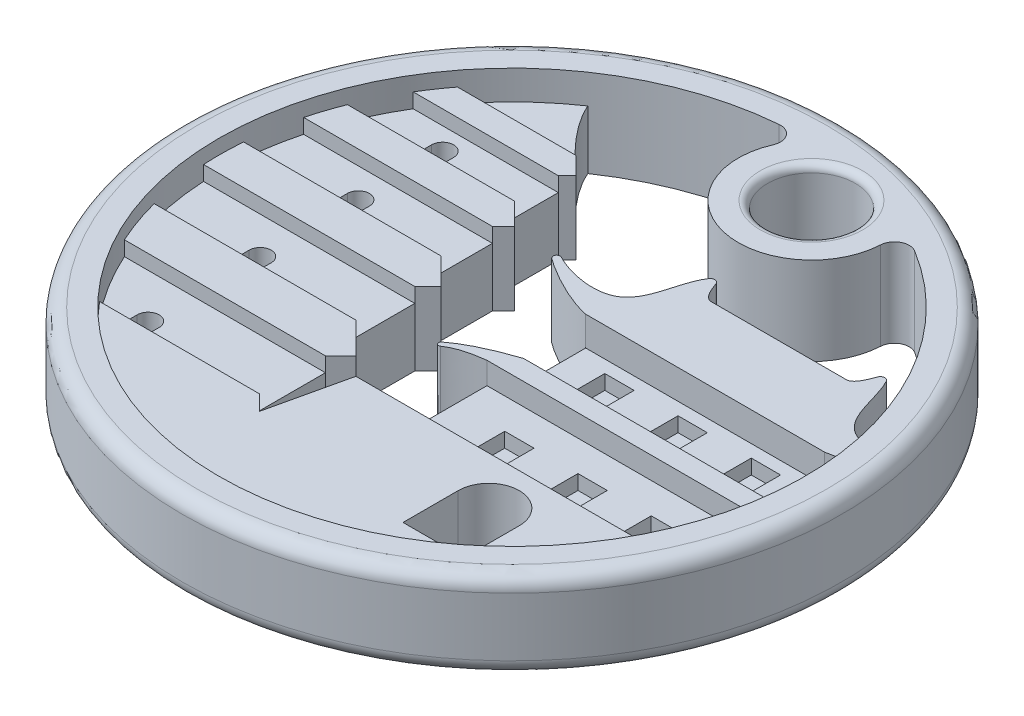
from build123d import *

# Parameters (mm, degrees)
SKETCH_1_R          = 22.5
SKETCH_1_R_2        = 20
EXTRUDE_1_DEPTH     = 6
EXTRUDE_2_DEPTH     = 4
EXTRUDE_3_DEPTH     = 5
EXTRUDE_5_DEPTH     = 4.5
SKETCH_3_5_W        = 18.604278743
SKETCH_3_5_H        = 5.922046806
SKETCH_3_5_W_2      = 16.316712287
SKETCH_3_5_H_2      = 4.236162185
EXTRUDE_6_DEPTH     = 3
SKETCH_4_W          = 2
SKETCH_4_H          = 2
CUT_EXTRUDE_1_DEPTH = 1
SKETCH_5_R          = 5
SKETCH_5_R_2        = 3
EXTRUDE_7_DEPTH     = 6
FILLET_1_R          = 1
EXTRUDE_8_DEPTH     = 1
FILLET_2_R          = 0.5
FILLET_3_R          = 1


with BuildPart() as part:
    # 草图1 → 凸台-拉伸1 (new body)
    with BuildSketch(Plane(origin=(0, 0, 0), x_dir=(1, 0, 0), z_dir=(0, 1, 0))):
        Circle(SKETCH_1_R)
        Circle(SKETCH_1_R_2, mode=Mode.SUBTRACT)
    extrude(amount=EXTRUDE_1_DEPTH)

    # 草图2 → 凸台-拉伸2 (add)
    with BuildSketch(Plane(origin=(0, 0, 0), x_dir=(1, 0, 0), z_dir=(0, 1, 0))):
        with BuildLine():
            Line((-6.59839511, 10.960667775), (-7.79839511, 12.160667775))
            add(Edge.make_bspline(
                [(-7.79839511, 12.160667775), (-7.798415018, 12.160687684), (-7.919621711, 12.281894369), (-11.841073405, 15.613438943), (-11.65646465, 18.176175119)],
                knots=[0, 0, 0, 0, 0.05, 1, 1, 1, 1], degree=3))
            ThreePointArc((-11.65646465, 18.176175119), (-21.125358879, -4.468301951), (-3.29839511, -21.339332225))
            Line((-3.29839511, -21.339332225), (-3.29839511, -16.339332225))
            Line((-3.29839511, -16.339332225), (-2.09839511, -15.139332225))
            Line((-2.09839511, -15.139332225), (-4.49839511, -12.739332225))
            Line((-4.49839511, -12.739332225), (-4.49839511, -8.239332225))
            Line((-4.49839511, -8.239332225), (-3.44839511, -7.189332225))
            Line((-3.44839511, -7.189332225), (-5.54839511, -5.089332225))
            Line((-5.54839511, -5.089332225), (-5.54839511, -1.089332225))
            Line((-5.54839511, -1.089332225), (-4.64839511, -0.189332225))
            Line((-4.64839511, -0.189332225), (-6.44839511, 1.610667775))
            Line((-6.44839511, 1.610667775), (-6.44839511, 5.110667775))
            Line((-6.44839511, 5.110667775), (-5.69839511, 5.860667775))
            Line((-5.69839511, 5.860667775), (-7.19839511, 7.360667775))
            Line((-7.19839511, 7.360667775), (-7.19839511, 10.360667775))
            Line((-7.19839511, 10.360667775), (-6.59839511, 10.960667775))
        make_face()
        with BuildLine():
            Line((-12.849435762, -12.739332225), (-14.349435762, -12.739332225))
            Line((-14.349435762, -12.739332225), (-14.349435762, -11.239332225))
            ThreePointArc((-14.349435762, -11.239332225), (-13.599435762, -10.489332225), (-12.849435762, -11.239332225))
            Line((-12.849435762, -11.239332225), (-12.849435762, -12.739332225))
        make_face(mode=Mode.SUBTRACT)
        with BuildLine():
            Line((-12.849435762, -5.089332225), (-14.349435762, -5.089332225))
            Line((-14.349435762, -5.089332225), (-14.349435762, -3.589332225))
            ThreePointArc((-14.349435762, -3.589332225), (-13.599435762, -2.839332225), (-12.849435762, -3.589332225))
            Line((-12.849435762, -3.589332225), (-12.849435762, -5.089332225))
        make_face(mode=Mode.SUBTRACT)
        with BuildLine():
            Line((-12.849435762, 1.610667775), (-14.349435762, 1.610667775))
            Line((-14.349435762, 1.610667775), (-14.349435762, 3.110667775))
            ThreePointArc((-14.349435762, 3.110667775), (-13.599435762, 3.860667775), (-12.849435762, 3.110667775))
            Line((-12.849435762, 3.110667775), (-12.849435762, 1.610667775))
        make_face(mode=Mode.SUBTRACT)
        with BuildLine():
            Line((-12.849435762, 7.360667775), (-14.349435762, 7.360667775))
            Line((-14.349435762, 7.360667775), (-14.349435762, 8.860667775))
            ThreePointArc((-14.349435762, 8.860667775), (-13.599435762, 9.610667775), (-12.849435762, 8.860667775))
            Line((-12.849435762, 8.860667775), (-12.849435762, 7.360667775))
        make_face(mode=Mode.SUBTRACT)
    extrude(amount=EXTRUDE_2_DEPTH)

    # 草图3 → 凸台-拉伸3 (add)
    # profile 1 of 2: a face of its own
    with BuildSketch(Plane(origin=(0, 0, 0), x_dir=(1, 0, 0), z_dir=(0, 1, 0))):
        Polygon((11.687038437, -18.083208612), (14.631685412, -15.44347942), (19.814320488, -8.412341061), (-2.244619852, -8.412341061), (-3.843916309, -15.44347942), (-3.843916309, -20.722937804), (1.032924215, -21.162044464), (7.157306577, -19.775391854), align=None)
        with BuildLine():
            Line((12.165702371, -15.44347942), (8.003131578, -15.44347942))
            Line((8.003131578, -15.44347942), (8.003131578, -11.673118932))
            ThreePointArc((8.003131578, -11.673118932), (8.612725957, -10.201427915), (10.084416974, -9.591833536))
            ThreePointArc((10.084416974, -9.591833536), (11.556107992, -10.201427915), (12.165702371, -11.673118932))
            Line((12.165702371, -11.673118932), (12.165702371, -15.44347942))
        make_face(mode=Mode.SUBTRACT)
    # profile 2 of 2: a face of its own
    with BuildSketch(Plane(origin=(0, 0, 0), x_dir=(1, 0, 0), z_dir=(0, 1, 0))):
        with BuildLine():
            Line((1.926060831, 3.106313863), (18.242773118, 3.106313863))
            add(Edge.make_bspline(
                [(20.49726349, 3.758938379), (19.799785792, 3.382148266), (18.970151593, 3.258262591), (18.242773118, 3.106313863)],
                knots=[0.620726919, 0.620726919, 0.620726919, 0.620726919, 1, 1, 1, 1], degree=3))
            Line((20.49726349, 3.758938379), (20.145013664, 4.948010129))
            add(Edge.make_bspline(
                [(16.154345484, 9.400093966), (16.92049611, 7.978093658), (16.867354273, 5.096762577), (19.555271012, 4.894019573), (20.145013664, 4.948010129)],
                knots=[0, 0, 0, 0, 0.619573201, 0.781573575, 0.781573575, 0.781573575, 0.781573575], degree=3))
            ThreePointArc((16.154345484, 9.400093966), (15.862588788, 9.55922706), (15.599078269, 9.356723931))
            add(Edge.make_bspline(
                [(15.599078269, 9.356723931), (15.459599835, 8.960274552), (15.160667215, 8.130763445), (14.702603414, 8.130763445)],
                knots=[0, 0, 0, 0, 1, 1, 1, 1], degree=3))
            Line((14.702603414, 8.130763445), (5.466230535, 8.130763445))
            add(Edge.make_bspline(
                [(4.56975568, 9.356723931), (4.709234114, 8.960274552), (5.008166733, 8.130763445), (5.466230535, 8.130763445)],
                knots=[0, 0, 0, 0, 1, 1, 1, 1], degree=3))
            ThreePointArc((4.56975568, 9.356723931), (4.321771685, 9.557612959), (4.030680789, 9.42677507))
            add(Edge.make_bspline(
                [(4.030680789, 9.42677507), (3.122985939, 8.090675629), (3.427309753, 4.256953296), (-1.047441871, 4.989905533), (-2.275269877, 5.643307417)],
                knots=[0, 0, 0, 0, 0.619573201, 1, 1, 1, 1], degree=3))
            ThreePointArc((-2.275269877, 5.643307417), (-2.582782761, 5.567141086), (-2.539928013, 5.253247864))
            add(Edge.make_bspline(
                [(-2.539928013, 5.253247864), (-2.234855409, 4.994580773), (0.008238259, 3.506945323), (1.926060831, 3.106313863)],
                knots=[0, 0, 0, 0, 1, 1, 1, 1], degree=3))
        make_face()
    extrude(amount=EXTRUDE_3_DEPTH)

    # 草图3<4> → 凸台-拉伸5 (add)
    with BuildSketch(Plane(origin=(0, 0, 0), x_dir=(1, 0, 0), z_dir=(0, 1, 0))):
        with BuildLine():
            Line((0.782277603, -2.490294255), (19.386556346, -2.490294255))
            add(Edge.make_bspline(
                [(19.386556346, -2.490294255), (20.985174967, -2.667750056), (21.803810915, -3.242047767)],
                knots=[0, 0, 0, 1, 1, 1], degree=2))
            ThreePointArc((21.803810915, -3.242047767), (22.050579216, -3.201550422), (22.015512803, -2.953952005))
            add(Edge.make_bspline(
                [(18.242773118, -1.129848322), (20.685207654, -1.930646184), (22.015512803, -2.953952005)],
                knots=[0, 0, 0, 1, 1, 1], degree=2))
            Line((18.242773118, -1.129848322), (1.926060831, -1.129848322))
            add(Edge.make_bspline(
                [(1.926060831, -1.129848322), (-0.516373705, -1.930646184), (-1.846678854, -2.953952005)],
                knots=[0, 0, 0, 1, 1, 1], degree=2))
            ThreePointArc((-1.846678854, -2.953952005), (-1.881745267, -3.201550422), (-1.634976966, -3.242047767))
            add(Edge.make_bspline(
                [(0.782277603, -2.490294255), (-0.816341018, -2.667750056), (-1.634976966, -3.242047767)],
                knots=[0, 0, 0, 1, 1, 1], degree=2))
        make_face()
    extrude(amount=EXTRUDE_5_DEPTH)

    # 草图3<5> → 凸台-拉伸6 (add)
    with BuildSketch(Plane(origin=(0, 0, 0), x_dir=(1, 0, 0), z_dir=(0, 1, 0))):
        with Locations((10.084416975, -5.451317658)):
            Rectangle(SKETCH_3_5_W, SKETCH_3_5_H)
        with Locations((10.084416975, 0.988232771)):
            Rectangle(SKETCH_3_5_W_2, SKETCH_3_5_H_2)
    extrude(amount=EXTRUDE_6_DEPTH)

    # 草图4 → 切除-拉伸1 (cut)
    with BuildSketch(Plane(origin=(0, 3, 0), x_dir=(1, 0, 0), z_dir=(0, 1, 0))):
        with Locations((5.084416974, 1.251619236)):
            Rectangle(SKETCH_4_W, SKETCH_4_H)
        with Locations((10.084416974, 1.251619236)):
            Rectangle(SKETCH_4_W, SKETCH_4_H)
        with Locations((15.084416974, 1.251619236)):
            Rectangle(SKETCH_4_W, SKETCH_4_H)
        with Locations((5.084416974, -5.580169906)):
            Rectangle(SKETCH_4_W, SKETCH_4_H)
        with Locations((10.084416974, -5.580169906)):
            Rectangle(SKETCH_4_W, SKETCH_4_H)
        with Locations((15.084416974, -5.580169906)):
            Rectangle(SKETCH_4_W, SKETCH_4_H)
    extrude(amount=-CUT_EXTRUDE_1_DEPTH, mode=Mode.SUBTRACT)

    # 草图5 → 凸台-拉伸7 (add)
    with BuildSketch(Plane(origin=(0, 0, 0), x_dir=(1, 0, 0), z_dir=(0, 1, 0))):
        with Locations((3.900951371, 16.546376594)):
            Circle(SKETCH_5_R)
        with Locations((3.900951371, 16.546376594)):
            Circle(SKETCH_5_R_2, mode=Mode.SUBTRACT)
    extrude(amount=EXTRUDE_7_DEPTH)

    # 圆角1
    fillet_1_edges = [part.edges().sort_by_distance(p)[0] for p in [
        (0.283444581, 3, -19.997991378),
        (8.679294903, 3, -18.01859706),
    ]]
    fillet(fillet_1_edges, radius=FILLET_1_R)

    # 草图6 → 凸台-拉伸8 (add)
    with BuildSketch(Plane(origin=(0, 4, 0), x_dir=(1, 0, 0), z_dir=(0, 1, 0))):
        with BuildLine():
            Line((-6.59839511, 10.960667775), (-7.79839511, 12.160667775))
            Line((-7.79839511, 12.160667775), (-15.878229097, 12.160667775))
            ThreePointArc((-15.878229097, 12.160667775), (-16.517256552, 11.277421513), (-17.107207933, 10.360667775))
            Line((-17.107207933, 10.360667775), (-7.19839511, 10.360667775))
            Line((-7.19839511, 10.360667775), (-6.59839511, 10.960667775))
        make_face()
        with BuildLine():
            Line((-4.49839511, -12.739332225), (-15.417827813, -12.739332225))
            ThreePointArc((-15.417827813, -12.739332225), (-10.228105534, -17.186793104), (-3.843916309, -19.62713192))
            Line((-3.843916309, -19.62713192), (-3.843916309, -15.44347942))
            Line((-3.843916309, -15.44347942), (-3.464094495, -13.773632839))
            Line((-3.464094495, -13.773632839), (-4.49839511, -12.739332225))
        make_face()
        with BuildLine():
            Line((-5.54839511, -5.089332225), (-19.341631201, -5.089332225))
            ThreePointArc((-19.341631201, -5.089332225), (-18.848723811, -6.68772089), (-18.223978833, -8.239332225))
            Line((-18.223978833, -8.239332225), (-4.49839511, -8.239332225))
            Line((-4.49839511, -8.239332225), (-3.44839511, -7.189332225))
            Line((-3.44839511, -7.189332225), (-5.54839511, -5.089332225))
        make_face()
        with BuildLine():
            Line((-6.44839511, 1.610667775), (-19.935038232, 1.610667775))
            ThreePointArc((-19.935038232, 1.610667775), (-19.998293459, 0.261263748), (-19.970311848, -1.089332225))
            Line((-19.970311848, -1.089332225), (-5.54839511, -1.089332225))
            Line((-5.54839511, -1.089332225), (-4.64839511, -0.189332225))
            Line((-4.64839511, -0.189332225), (-6.44839511, 1.610667775))
        make_face()
        with BuildLine():
            Line((-7.19839511, 7.360667775), (-18.596251501, 7.360667775))
            ThreePointArc((-18.596251501, 7.360667775), (-18.999464169, 6.246627992), (-19.336004626, 5.110667775))
            Line((-19.336004626, 5.110667775), (-6.44839511, 5.110667775))
            Line((-6.44839511, 5.110667775), (-5.69839511, 5.860667775))
            Line((-5.69839511, 5.860667775), (-7.19839511, 7.360667775))
        make_face()
    extrude(amount=EXTRUDE_8_DEPTH)

    # 圆角2
    fillet_2_edges = [part.edges().sort_by_distance(p)[0] for p in [
        (0.900951371, 6, -16.546376594),
        (0.900951371, 0, -16.546376594),
    ]]
    fillet(fillet_2_edges, radius=FILLET_2_R)

    # 圆角3
    fillet_3_edges = [part.edges().sort_by_distance(p)[0] for p in [
        (-22.5, 0, 0),
        (-22.5, 6, 0),
    ]]
    fillet(fillet_3_edges, radius=FILLET_3_R)


solid = part.part
